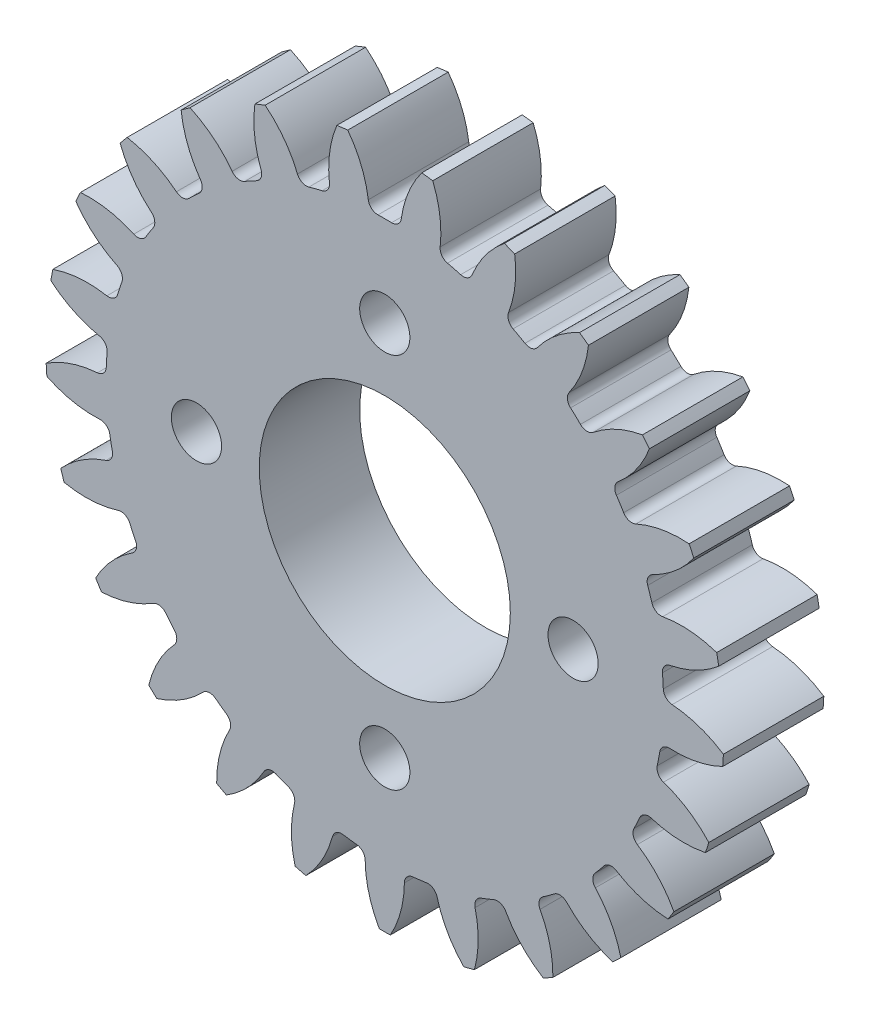
from build123d import *

# Parameters (mm, degrees)
SKETCH1_R                = 13.5
SKETCH1_R_2              = 5
SKETCH1_R_3              = 1
BOSS_EXTRUDE1_DEPTH      = 10
CUT_EXTRUDE3_START       = -10
CUT_EXTRUDE3_DEPTH       = 32.552262062
FILLET1_R                = 0.38
CIRPATTERN1_COUNT        = 25
FILLET1_OF_CIRPATTERN1_R = 0.38
CUT_EXTRUDE9_DEPTH       = 6
CUT_EXTRUDE9_DEPTH_BACK  = 22.543103055
SKETCH9_R                = 16.213384396


with BuildPart() as part:
    # Sketch1 → Boss-Extrude1 (new body)
    with BuildSketch(Plane.XY):
        Circle(SKETCH1_R)
        Circle(SKETCH1_R_2, mode=Mode.SUBTRACT)
        with Locations((-7.5, 0)):
            Circle(SKETCH1_R_3, mode=Mode.SUBTRACT)
        with Locations((0, 7.5)):
            Circle(SKETCH1_R_3, mode=Mode.SUBTRACT)
        with Locations((7.5, 0)):
            Circle(SKETCH1_R_3, mode=Mode.SUBTRACT)
        with Locations((0, -7.5)):
            Circle(SKETCH1_R_3, mode=Mode.SUBTRACT)
    extrude(amount=BOSS_EXTRUDE1_DEPTH)

    # Sketch2 → Cut-Extrude3 (cut)
    with BuildSketch(Plane.XY.offset(10).offset(CUT_EXTRUDE3_START)):
        with BuildLine():
            Line((44.349450934, 70.771523784), (1.473779826, 13.419313433))
            ThreePointArc((1.473779826, 13.419313433), (0.876171823, 12.313628186), (0.623245336, 11.082489127))
            ThreePointArc((0.623245336, 11.082489127), (0, 11.1), (-0.623245336, 11.082489127))
            ThreePointArc((-0.623245336, 11.082489127), (-0.876171823, 12.313628186), (-1.473779826, 13.419313433))
            Line((-1.473779826, 13.419313433), (-44.349450934, 70.771523784))
            Line((-44.349450934, 70.771523784), (-44.349450934, 213.986037085))
            Line((-44.349450934, 213.986037085), (44.349450934, 213.986037085))
            Line((44.349450934, 213.986037085), (44.349450934, 70.771523784))
        make_face()
    cut_extrude3 = extrude(amount=CUT_EXTRUDE3_DEPTH, mode=Mode.SUBTRACT)

    # Fillet1
    fillet1_edges = [part.edges().sort_by_distance(p)[0] for p in [
        (0.623245336, 11.082489127, 5),
        (-0.623245336, 11.082489127, 5),
    ]]
    fillet(fillet1_edges, radius=FILLET1_R)

    # CirPattern1: Cut-Extrude3 ×25 about axis
    cirpattern1_axis = Axis((0, 0, 0), (0, 0, 1))
    for i in range(1, CIRPATTERN1_COUNT):
        add(cut_extrude3.rotate(cirpattern1_axis, i * 360 / CIRPATTERN1_COUNT), mode=Mode.SUBTRACT)

    # Fillet1 of CirPattern1
    fillet1_of_cirpattern1_edges = [part.edges().sort_by_distance(p)[0] for p in [
        (-2.152438033, 10.889307164, 5),
        (-3.359767908, 10.57931754, 5),
        (-4.792875804, 10.011909984, 5),
        (-5.885183906, 9.411408523, 5),
        (-7.132159562, 8.505427678, 5),
        (-8.040812155, 7.652146097, 5),
        (-9.023303503, 6.464518071, 5),
        (-9.691206605, 5.412071188, 5),
        (-10.347480101, 4.017419018, 5),
        (-10.732666901, 2.831935943, 5),
        (-11.021486468, 1.317890753, 5),
        (-11.099754265, 0.073859747, 5),
        (-11.002972306, -1.464445434, 5),
        (-10.769403246, -2.688857329, 5),
        (-10.293100928, -4.154765129, 5),
        (-9.762371013, -5.282623609, 5),
        (-8.936476164, -6.584025651, 5),
        (-8.141933107, -7.54446322, 5),
        (-7.018339736, -8.599587627, 5),
        (-6.009907599, -9.332256461, 5),
        (-4.659215211, -10.074805885, 5),
        (-3.500257494, -10.533669706, 5),
        (-2.007335058, -10.916987037, 5),
        (-0.770673338, -11.073213743, 5),
        (0.770673338, -11.073213743, 5),
        (2.007335058, -10.916987037, 5),
        (3.500257494, -10.533669706, 5),
        (4.659215211, -10.074805885, 5),
        (6.009907599, -9.332256461, 5),
        (7.018339736, -8.599587627, 5),
        (8.141933107, -7.54446322, 5),
        (8.936476164, -6.584025651, 5),
        (9.762371013, -5.282623609, 5),
        (10.293100928, -4.154765129, 5),
        (10.769403246, -2.688857329, 5),
        (11.002972306, -1.464445434, 5),
        (11.099754265, 0.073859747, 5),
        (11.021486468, 1.317890753, 5),
        (10.732666901, 2.831935943, 5),
        (10.347480101, 4.017419018, 5),
        (9.691206605, 5.412071188, 5),
        (9.023303503, 6.464518071, 5),
        (8.040812155, 7.652146097, 5),
        (7.132159562, 8.505427678, 5),
        (5.885183906, 9.411408523, 5),
        (4.792875804, 10.011909984, 5),
        (3.359767908, 10.57931754, 5),
        (2.152438033, 10.889307164, 5),
    ]]
    fillet(fillet1_of_cirpattern1_edges, radius=FILLET1_OF_CIRPATTERN1_R)

    # Sketch9 → Cut-Extrude9 (cut, two sides: drawn at the far end of the back side and taken through both)
    with BuildSketch(Plane.XY.offset(-CUT_EXTRUDE9_DEPTH_BACK)):
        Circle(SKETCH9_R)
    extrude(amount=CUT_EXTRUDE9_DEPTH + CUT_EXTRUDE9_DEPTH_BACK, mode=Mode.SUBTRACT)


solid = part.part
